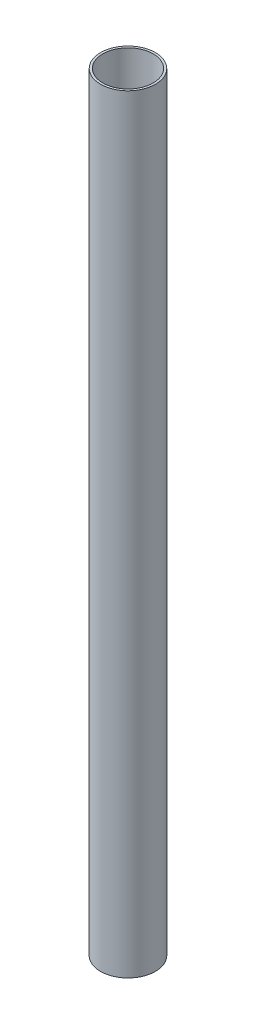
from build123d import *

# Parameters (mm, degrees)
SKETCH_1_R      = 25
SKETCH_1_R_2    = 23
EXTRUDE_1_DEPTH = 700


with BuildPart() as part:
    # Эскиз1 → Бобышка-Вытянуть1 (new body)
    with BuildSketch(Plane(origin=(0, 0, 0), x_dir=(1, 0, 0), z_dir=(0, 1, 0))):
        with Locations(Location((0, 0, 0), (0, 0, 270))):
            Circle(SKETCH_1_R)
        with Locations(Location((0, 0, 0), (0, 0, 270))):
            Circle(SKETCH_1_R_2, mode=Mode.SUBTRACT)
    extrude(amount=EXTRUDE_1_DEPTH)


solid = part.part
